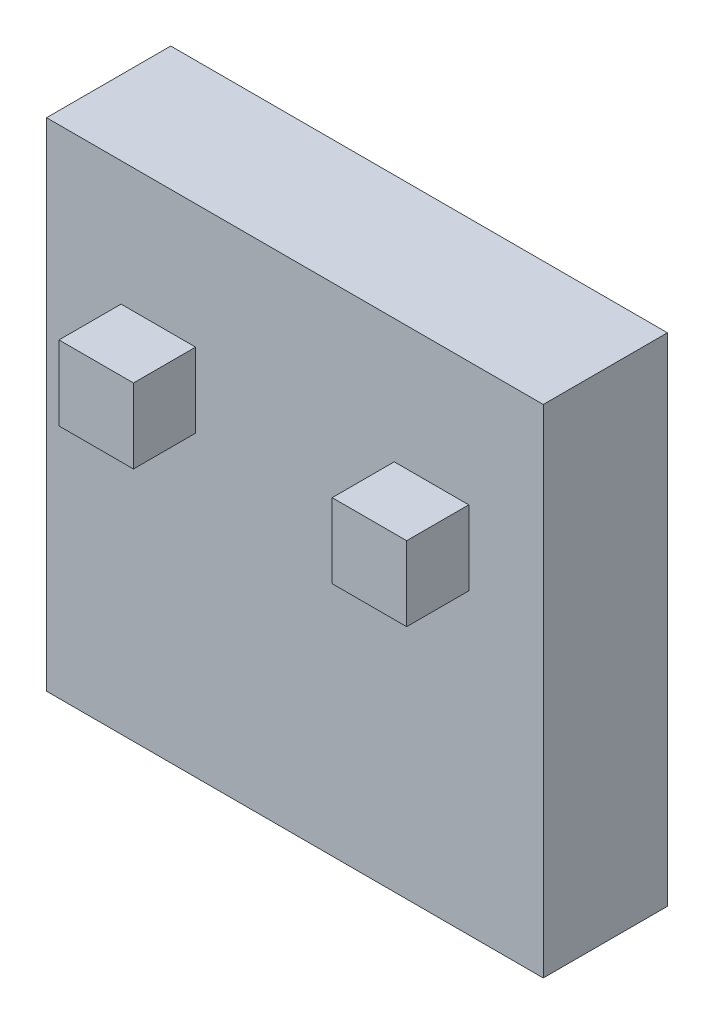
from build123d import *

# Parameters (mm, degrees)
SKETCH1_W           = 40
SKETCH1_H           = 40
BOSS_EXTRUDE1_DEPTH = 10
SKETCH2_W           = 6
SKETCH2_H           = 6
CUT_EXTRUDE1_DEPTH  = 5
SKETCH3_W           = 6
SKETCH3_H           = 6
BOSS_EXTRUDE2_DEPTH = 5


with BuildPart() as part:
    # Sketch1 → Boss-Extrude1 (new body)
    with BuildSketch(Plane.XY):
        with Locations((0, 20)):
            Rectangle(SKETCH1_W, SKETCH1_H)
    extrude(amount=BOSS_EXTRUDE1_DEPTH)

    # Sketch2 → Cut-Extrude1 (cut)
    with BuildSketch(Plane.XY):
        with Locations((-11, 11)):
            Rectangle(SKETCH2_W, SKETCH2_H)
    cut_extrude1 = extrude(amount=CUT_EXTRUDE1_DEPTH, mode=Mode.SUBTRACT)

    # Sketch3 → Boss-Extrude2 (add)
    with BuildSketch(Plane.XY.offset(10)):
        with Locations((-11, 27)):
            Rectangle(SKETCH3_W, SKETCH3_H)
    boss_extrude2 = extrude(amount=BOSS_EXTRUDE2_DEPTH)

    # Mirror1: Cut-Extrude1, Boss-Extrude2 across plane
    add(cut_extrude1.mirror(Plane(origin=(0, 0, 0), x_dir=(0, 0, 1), z_dir=(1, 0, 0))), mode=Mode.SUBTRACT)
    add(boss_extrude2.mirror(Plane(origin=(0, 0, 0), x_dir=(0, 0, 1), z_dir=(1, 0, 0))))


solid = part.part
